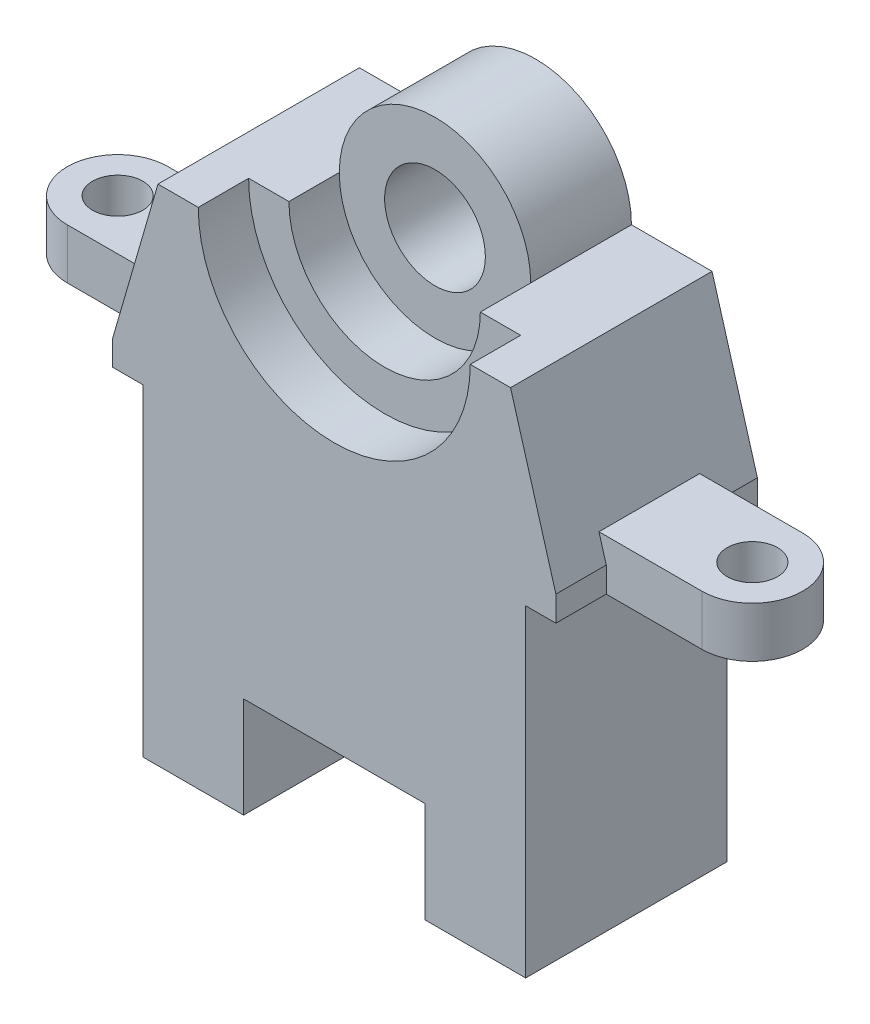
from build123d import *

# Parameters (mm, degrees)
BOSS_EXTRUDE1_DEPTH = 40
SKETCH2_R           = 27
CUT_EXTRUDE3_DEPTH  = 10
SKETCH4_R           = 19
CUT_EXTRUDE4_DEPTH  = 10
SKETCH5_R           = 19
BOSS_EXTRUDE2_DEPTH = 20
SKETCH6_R           = 10
CUT_EXTRUDE6_DEPTH  = 20
BOSS_EXTRUDE4_START = 64
SKETCH7_R           = 5
BOSS_EXTRUDE4_DEPTH = 10


with BuildPart() as part:
    # Sketch1 → Boss-Extrude1 (new body)
    with BuildSketch(Plane.XY):
        Polygon((0, 0), (0, 64), (-6, 64), (-6, 69), (3, 100), (73, 100), (82, 69), (82, 64), (76, 64), (76, 0), (56, 0), (56, 20), (20, 20), (20, 0), align=None)
    extrude(amount=BOSS_EXTRUDE1_DEPTH)

    # Sketch2 → Cut-Extrude3 (cut)
    with BuildSketch(Plane.XY.offset(40)):
        with Locations((38, 100)):
            Circle(SKETCH2_R)
    extrude(amount=-CUT_EXTRUDE3_DEPTH, mode=Mode.SUBTRACT)

    # Sketch4 → Cut-Extrude4 (cut)
    with BuildSketch(Plane.XY.offset(30)):
        with Locations((38, 100)):
            Circle(SKETCH4_R)
    extrude(amount=-CUT_EXTRUDE4_DEPTH, mode=Mode.SUBTRACT)

    # Sketch5 → Boss-Extrude2 (add)
    with BuildSketch(Plane.XY.offset(20)):
        with Locations((38, 100)):
            Circle(SKETCH5_R)
    extrude(amount=-BOSS_EXTRUDE2_DEPTH)

    # Sketch6 → Cut-Extrude6 (cut)
    with BuildSketch(Plane.XY.offset(20)):
        with Locations((38, 100)):
            Circle(SKETCH6_R)
    extrude(amount=-CUT_EXTRUDE6_DEPTH, mode=Mode.SUBTRACT)

    # Sketch7 → Boss-Extrude4 (add)
    # profile 1 of 2: a face of its own
    with BuildSketch(Plane(origin=(0, 0, 0), x_dir=(1, 0, 0), z_dir=(0, 1, 0)).offset(BOSS_EXTRUDE4_START)):
        with BuildLine():
            Line((82, -10), (77.667968987, -10))
            Line((77.667968987, -10), (77.667968987, -30))
            Line((77.667968987, -30), (82, -30))
            Line((82, -30), (101, -30))
            ThreePointArc((101, -30), (111, -20), (101, -10))
            Line((101, -10), (82, -10))
        make_face()
        with Locations(Location((101, -20, 0), (0, 0, 90))):
            Circle(SKETCH7_R, mode=Mode.SUBTRACT)
    # profile 2 of 2: a face of its own
    with BuildSketch(Plane(origin=(0, 0, 0), x_dir=(1, 0, 0), z_dir=(0, 1, 0)).offset(BOSS_EXTRUDE4_START)):
        with BuildLine():
            Line((-6, -10), (-2.389922535, -10))
            Line((-2.389922535, -10), (-2.389922535, -30))
            Line((-2.389922535, -30), (-6, -30))
            Line((-6, -30), (-25, -30))
            ThreePointArc((-25, -30), (-35, -20), (-25, -10))
            Line((-25, -10), (-6, -10))
        make_face()
        with Locations(Location((-25, -20, 0), (0, 0, 270))):
            Circle(SKETCH7_R, mode=Mode.SUBTRACT)
    extrude(amount=BOSS_EXTRUDE4_DEPTH)


solid = part.part
